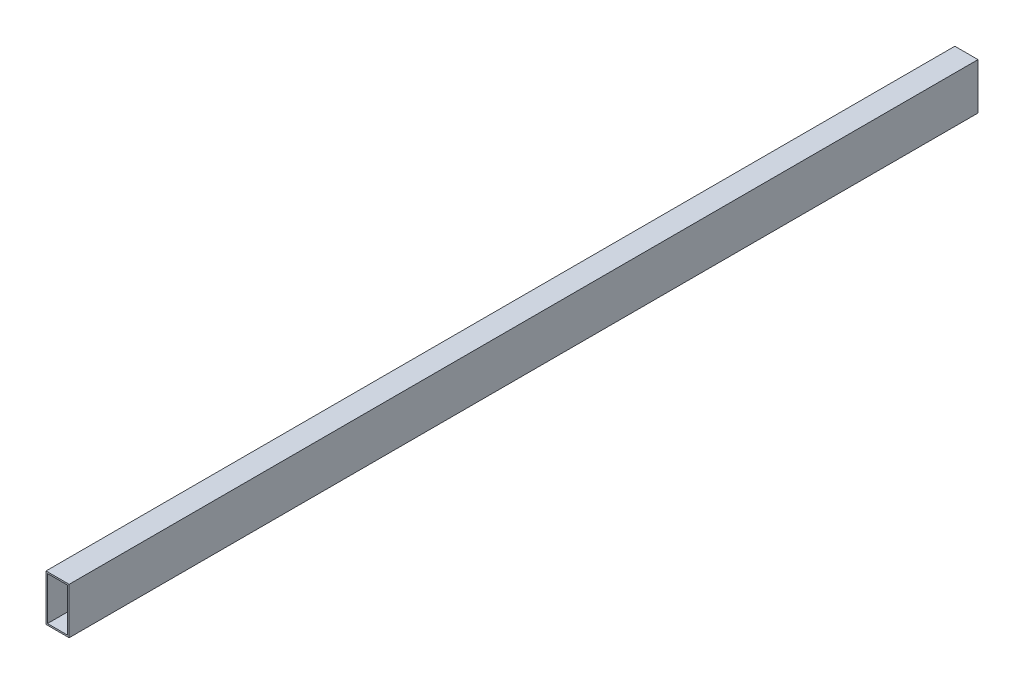
from build123d import *

# Parameters (mm, degrees)
SKETCH1_W           = 25.4
SKETCH1_H           = 50.8
BOSS_EXTRUDE1_DEPTH = 996.95
SKETCH2_W           = 22.098
SKETCH2_H           = 47.498
CUT_EXTRUDE1_DEPTH  = 999.582730989


with BuildPart() as part:
    # Sketch1 → Boss-Extrude1 (new body)
    with BuildSketch(Plane.XY):
        with Locations((-35.737209302, -4.799418605)):
            Rectangle(SKETCH1_W, SKETCH1_H)
    extrude(amount=BOSS_EXTRUDE1_DEPTH)

    # Sketch2 → Cut-Extrude1 (cut, through all)
    with BuildSketch(Plane.XY.offset(996.95)):
        with Locations((-35.737209302, -4.799418605)):
            Rectangle(SKETCH2_W, SKETCH2_H)
    extrude(amount=-CUT_EXTRUDE1_DEPTH, mode=Mode.SUBTRACT)


solid = part.part
